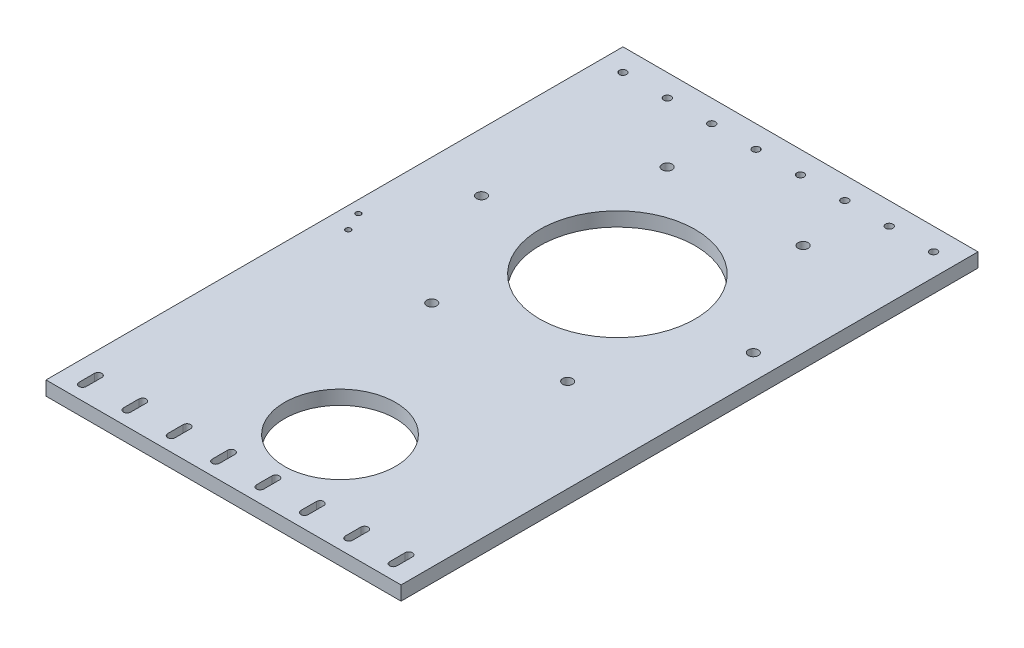
from build123d import *

# Parameters (mm, degrees)
SKETCH1_W           = 160
SKETCH1_H           = 260
SKETCH1_R           = 35
SKETCH1_R_2         = 25
SKETCH1_R_3         = 2.25
SKETCH1_R_4         = 1.175
SKETCH1_R_5         = 1.65
BOSS_EXTRUDE1_DEPTH = 6.35


with BuildPart() as part:
    # Sketch1 → Boss-Extrude1 (new body)
    with BuildSketch(Plane(origin=(0, 0, 0), x_dir=(1, 0, 0), z_dir=(0, 1, 0))):
        with Locations((80, 130)):
            Rectangle(SKETCH1_W, SKETCH1_H)
        with Locations(Location((87.5, 170, 0), (0, 0, 270))):
            Circle(SKETCH1_R, mode=Mode.SUBTRACT)
        with Locations(Location((87.5, 45, 0), (0, 0, 270))):
            Circle(SKETCH1_R_2, mode=Mode.SUBTRACT)
        with Locations(Location((148.75, 170, 0), (0, 0, 270))):
            Circle(SKETCH1_R_3, mode=Mode.SUBTRACT)
        with Locations(Location((118.125, 116.955944018, 0), (0, 0, 270))):
            Circle(SKETCH1_R_3, mode=Mode.SUBTRACT)
        with Locations(Location((56.875, 116.955944018, 0), (0, 0, 270))):
            Circle(SKETCH1_R_3, mode=Mode.SUBTRACT)
        with Locations(Location((26.25, 170, 0), (0, 0, 270))):
            Circle(SKETCH1_R_3, mode=Mode.SUBTRACT)
        with Locations(Location((56.875, 223.044055982, 0), (0, 0, 270))):
            Circle(SKETCH1_R_3, mode=Mode.SUBTRACT)
        with Locations(Location((118.125, 223.044055982, 0), (0, 0, 270))):
            Circle(SKETCH1_R_3, mode=Mode.SUBTRACT)
        with Locations(Location((5.475532842, 135.298909731, 0), (0, 0, 270))):
            Circle(SKETCH1_R_4, mode=Mode.SUBTRACT)
        with Locations(Location((9.516263037, 126.701090269, 0), (0, 0, 270))):
            Circle(SKETCH1_R_4, mode=Mode.SUBTRACT)
        with Locations(Location((10, 250, 0), (0, 0, 270))):
            Circle(SKETCH1_R_5, mode=Mode.SUBTRACT)
        with Locations(Location((30, 250, 0), (0, 0, 270))):
            Circle(SKETCH1_R_5, mode=Mode.SUBTRACT)
        with Locations(Location((50, 250, 0), (0, 0, 270))):
            Circle(SKETCH1_R_5, mode=Mode.SUBTRACT)
        with Locations(Location((70, 250, 0), (0, 0, 270))):
            Circle(SKETCH1_R_5, mode=Mode.SUBTRACT)
        with Locations(Location((90, 250, 0), (0, 0, 270))):
            Circle(SKETCH1_R_5, mode=Mode.SUBTRACT)
        with Locations(Location((110, 250, 0), (0, 0, 270))):
            Circle(SKETCH1_R_5, mode=Mode.SUBTRACT)
        with Locations(Location((130, 250, 0), (0, 0, 270))):
            Circle(SKETCH1_R_5, mode=Mode.SUBTRACT)
        with Locations(Location((150, 250, 0), (0, 0, 270))):
            Circle(SKETCH1_R_5, mode=Mode.SUBTRACT)
        with BuildLine():
            Line((8.35, 6.5), (8.35, 13.5))
            ThreePointArc((8.35, 13.5), (10, 15.15), (11.65, 13.5))
            Line((11.65, 13.5), (11.65, 6.5))
            ThreePointArc((11.65, 6.5), (10, 4.85), (8.35, 6.5))
        make_face(mode=Mode.SUBTRACT)
        with BuildLine():
            Line((31.65, 6.5), (31.65, 13.5))
            ThreePointArc((31.65, 13.5), (30, 15.15), (28.35, 13.5))
            Line((28.35, 13.5), (28.35, 6.5))
            ThreePointArc((28.35, 6.5), (30, 4.85), (31.65, 6.5))
        make_face(mode=Mode.SUBTRACT)
        with BuildLine():
            Line((51.65, 6.5), (51.65, 13.5))
            ThreePointArc((51.65, 13.5), (50, 15.15), (48.35, 13.5))
            Line((48.35, 13.5), (48.35, 6.5))
            ThreePointArc((48.35, 6.5), (50, 4.85), (51.65, 6.5))
        make_face(mode=Mode.SUBTRACT)
        with BuildLine():
            Line((71.65, 6.5), (71.65, 13.5))
            ThreePointArc((71.65, 13.5), (70, 15.15), (68.35, 13.5))
            Line((68.35, 13.5), (68.35, 6.5))
            ThreePointArc((68.35, 6.5), (70, 4.85), (71.65, 6.5))
        make_face(mode=Mode.SUBTRACT)
        with BuildLine():
            Line((91.65, 6.5), (91.65, 13.5))
            ThreePointArc((91.65, 13.5), (90, 15.15), (88.35, 13.5))
            Line((88.35, 13.5), (88.35, 6.5))
            ThreePointArc((88.35, 6.5), (90, 4.85), (91.65, 6.5))
        make_face(mode=Mode.SUBTRACT)
        with BuildLine():
            Line((111.65, 6.5), (111.65, 13.5))
            ThreePointArc((111.65, 13.5), (110, 15.15), (108.35, 13.5))
            Line((108.35, 13.5), (108.35, 6.5))
            ThreePointArc((108.35, 6.5), (110, 4.85), (111.65, 6.5))
        make_face(mode=Mode.SUBTRACT)
        with BuildLine():
            Line((131.65, 6.5), (131.65, 13.5))
            ThreePointArc((131.65, 13.5), (130, 15.15), (128.35, 13.5))
            Line((128.35, 13.5), (128.35, 6.5))
            ThreePointArc((128.35, 6.5), (130, 4.85), (131.65, 6.5))
        make_face(mode=Mode.SUBTRACT)
        with BuildLine():
            Line((151.65, 6.5), (151.65, 13.5))
            ThreePointArc((151.65, 13.5), (150, 15.15), (148.35, 13.5))
            Line((148.35, 13.5), (148.35, 6.5))
            ThreePointArc((148.35, 6.5), (150, 4.85), (151.65, 6.5))
        make_face(mode=Mode.SUBTRACT)
    extrude(amount=BOSS_EXTRUDE1_DEPTH)


solid = part.part
